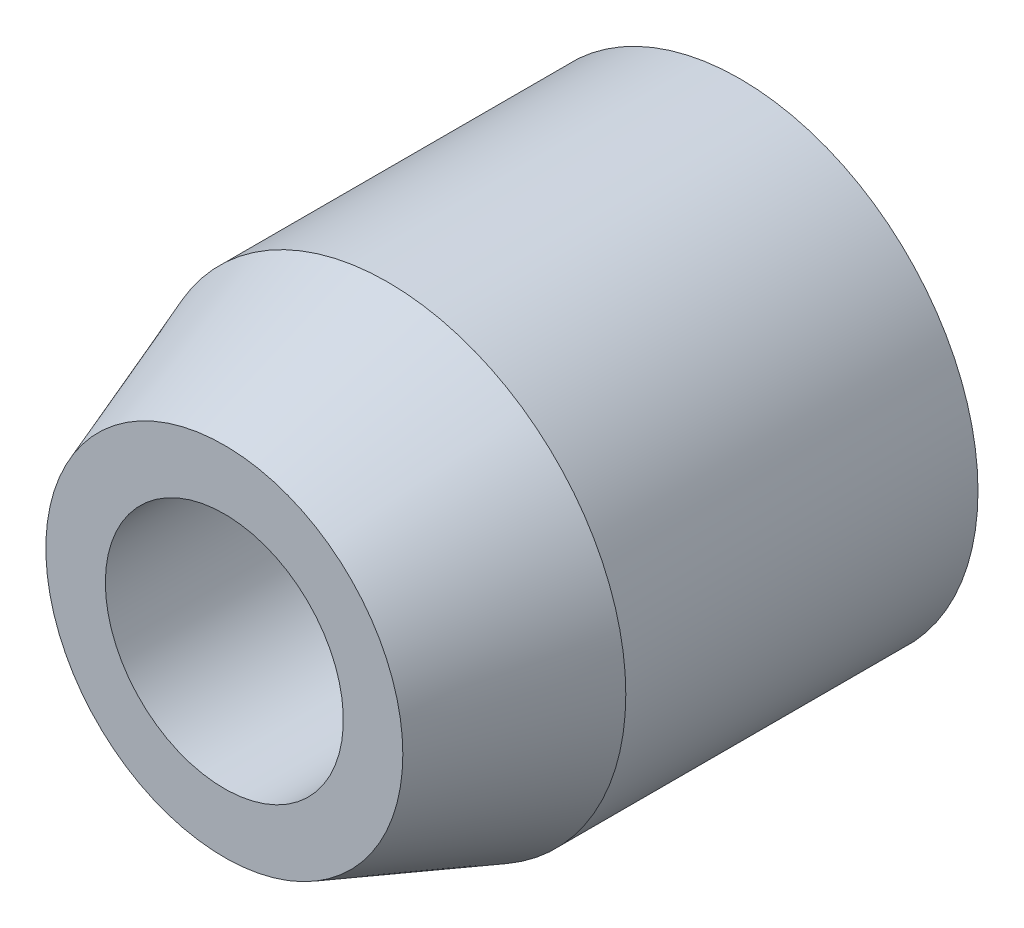
from build123d import *

# Parameters (mm, degrees)
CROQUIS2_R              = 6
CROQUIS2_R_2            = 3
SALIENTE_EXTRUIR1_DEPTH = 13
CROQUIS3_OUTSIDE_W      = 21.916
CROQUIS3_OUTSIDE_H      = 21.916
CROQUIS3_OUTSIDE_R      = 4.5
CORTAR_EXTRUIR3_DEPTH   = 5
CORTAR_EXTRUIR3_DRAFT   = -20


with BuildPart() as part:
    # Croquis2 → Saliente-Extruir1 (new body)
    with BuildSketch(Plane.XY):
        with Locations(Location((0, 0, 0), (0, 0, 180))):
            Circle(CROQUIS2_R)
        with Locations(Location((0, 0, 0), (0, 0, 180))):
            Circle(CROQUIS2_R_2, mode=Mode.SUBTRACT)
    extrude(amount=SALIENTE_EXTRUIR1_DEPTH)


with BuildPart() as cortar_extruir3_tool:
    # Croquis3 outside → Cortar-Extruir3 (with draft: the straight prism first)
    with BuildSketch(Plane.XY.offset(13)):
        Rectangle(CROQUIS3_OUTSIDE_W, CROQUIS3_OUTSIDE_H)
        Circle(CROQUIS3_OUTSIDE_R, mode=Mode.SUBTRACT)
    extrude(amount=-CORTAR_EXTRUIR3_DEPTH)
    # Cortar-Extruir3: the draft: its side faces are tilted about the plane it starts from
    cortar_extruir3_sides = [cortar_extruir3_tool.faces().sort_by_distance(p)[0] for p in [
        (0, -10.958, 10.5),
        (10.958, 0, 10.5),
        (0, 10.958, 10.5),
        (-10.958, 0, 10.5),
        (-4.5, 0, 10.5),
    ]]
    draft(cortar_extruir3_sides, Plane.XY.offset(13), CORTAR_EXTRUIR3_DRAFT)


with BuildPart() as part_1:
    add(part.part)

    # Cortar-Extruir3: cut by cortar_extruir3_tool
    add(cortar_extruir3_tool.part, mode=Mode.SUBTRACT)


solid = part_1.part
